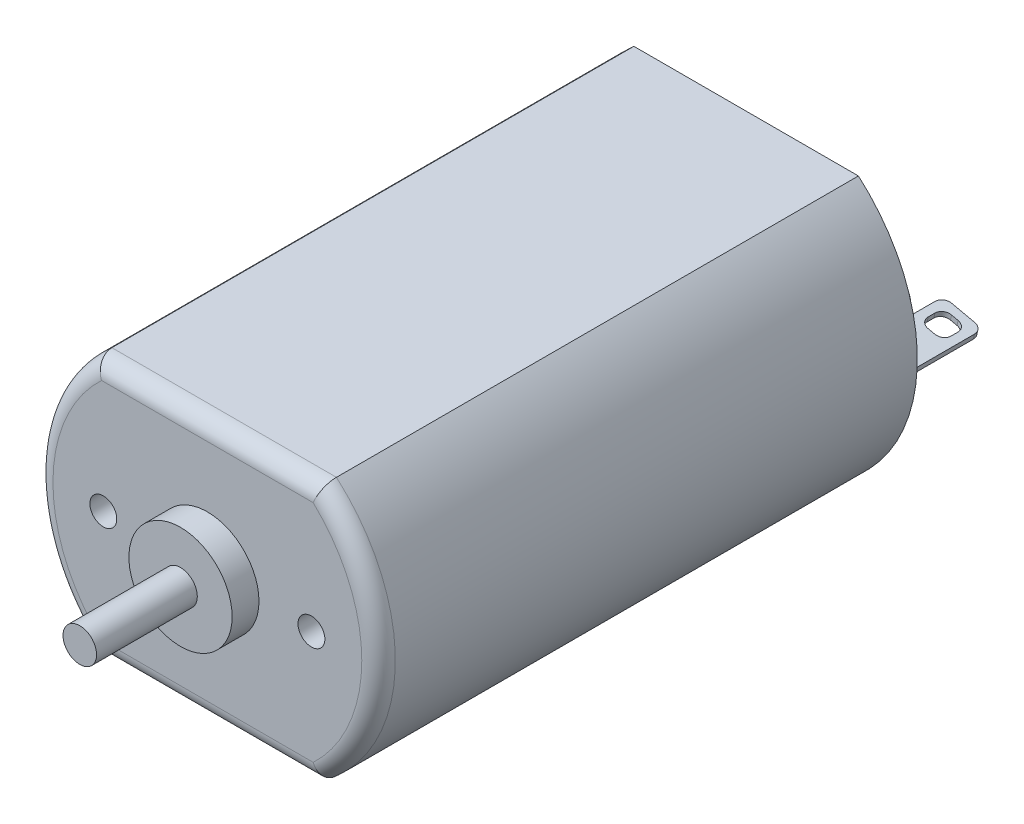
from build123d import *

# Parameters (mm, degrees)
BOSS_EXTRUDE1_DEPTH      = 32.1
SKETCH2_R                = 3.075
BOSS_EXTRUDE2_DEPTH      = 1.6
BOSS_EXTRUDE3_START      = 2.1
SKETCH3_R                = 3.075
BOSS_EXTRUDE3_DEPTH      = 2.1
M2_TAPPED_HOLE1_D        = 1.6
M2_TAPPED_HOLE1_DEPTH    = 6
M2_TAPPED_HOLE1_TIP      = 0.480688495
SKETCH6_R                = 1.2
SKETCH6_R_2              = 1.5
BOSS_EXTRUDE4_DEPTH      = 1
SKETCH7_R                = 1
BOSS_EXTRUDE5_DEPTH      = 6
FILLET1_R                = 1
FILLET2_R                = 0.5
BOSS_EXTRUDE6_DEPTH      = 0.15
BOSS_EXTRUDE6_DEPTH_BACK = 0.15
SKETCH9_W                = 1.4
SKETCH9_H                = 1.4
FILLET3_R                = 0.5


with BuildPart() as part:
    # Sketch1 → Boss-Extrude1 (new body)
    with BuildSketch(Plane.XY):
        with BuildLine():
            Line((-6.68954408, 7.7), (6.68954408, 7.7))
            ThreePointArc((6.68954408, 7.7), (10.2, 0), (6.68954408, -7.7))
            Line((6.68954408, -7.7), (-6.68954408, -7.7))
            ThreePointArc((-6.68954408, -7.7), (-10.2, 0), (-6.68954408, 7.7))
        make_face()
    extrude(amount=BOSS_EXTRUDE1_DEPTH)

    # Sketch2 → Boss-Extrude2 (add)
    with BuildSketch(Plane.XY.offset(32.1)):
        Circle(SKETCH2_R)
    extrude(amount=BOSS_EXTRUDE2_DEPTH)

    # Sketch3 → Boss-Extrude3 (add)
    with BuildSketch(Plane(origin=(0, 0, 0), x_dir=(-1, 0, 0), z_dir=(0, 0, -1)).offset(BOSS_EXTRUDE3_START)):
        Circle(SKETCH3_R)
    extrude(amount=-BOSS_EXTRUDE3_DEPTH)

    # M2 Tapped Hole1
    with Locations(Plane.XY.offset(32.1)):
        with Locations((-6.2, 0), (6.2, 0)):
            Hole(M2_TAPPED_HOLE1_D / 2, depth=M2_TAPPED_HOLE1_DEPTH)
            with Locations((0, 0, -(M2_TAPPED_HOLE1_DEPTH + M2_TAPPED_HOLE1_TIP / 2))):  # 118° drill point
                Cone(0, M2_TAPPED_HOLE1_D / 2, M2_TAPPED_HOLE1_TIP, mode=Mode.SUBTRACT)

    # Sketch6 → Boss-Extrude4 (add)
    with BuildSketch(Plane(origin=(0, 0, 0), x_dir=(-1, 0, 0), z_dir=(0, 0, -1))):
        with Locations((-7.6, 1.69)):
            Circle(SKETCH6_R)
        with Locations((7.6, -1.69)):
            Circle(SKETCH6_R)
        with Locations((-7.6, -1.69)):
            Circle(SKETCH6_R_2)
        with Locations((7.6, 1.69)):
            Circle(SKETCH6_R_2)
    extrude(amount=BOSS_EXTRUDE4_DEPTH)

    # Sketch7 → Boss-Extrude5 (add)
    with BuildSketch(Plane.XY.offset(33.7)):
        Circle(SKETCH7_R)
    extrude(amount=BOSS_EXTRUDE5_DEPTH)

    # Fillet1
    fillet1_edges = [part.edges().sort_by_distance(p)[0] for p in [
        (0, -7.7, 32.1),
        (10.2, 0, 32.1),
        (0, 7.7, 32.1),
        (-10.2, 0, 32.1),
    ]]
    fillet(fillet1_edges, radius=FILLET1_R)

    # Fillet2
    fillet2_edges = [part.edges().sort_by_distance(p)[0] for p in [
        (3.075, 0, 0),
        (3.075, 0, -2.1),
    ]]
    fillet(fillet2_edges, radius=FILLET2_R)

    # Sketch9 → Boss-Extrude6 (add, two sides: drawn at the far end of the back side and taken through both)
    # profile 1 of 2: a face of its own
    with BuildSketch(Plane(origin=(0, 0, 0), x_dir=(-0.9761568291371078, 0.2170664527949621, 0), z_dir=(-0.21706645279496206, -0.9761568291371077, 0)).offset(-BOSS_EXTRUDE6_DEPTH_BACK)):
        with BuildLine():
            Line((-8.985634207, 1), (-6.585634207, 1))
            Line((-6.585634207, 1), (-6.585634207, 4.8))
            ThreePointArc((-6.585634207, 4.8), (-6.732080816, 5.153553391), (-7.085634207, 5.3))
            Line((-7.085634207, 5.3), (-8.485634207, 5.3))
            ThreePointArc((-8.485634207, 5.3), (-8.839187597, 5.153553391), (-8.985634207, 4.8))
            Line((-8.985634207, 4.8), (-8.985634207, 1))
        make_face()
        with Locations((-7.785634207, 4.1)):
            Rectangle(SKETCH9_W, SKETCH9_H, mode=Mode.SUBTRACT)
    # profile 2 of 2: a face of its own
    with BuildSketch(Plane(origin=(0, 0, 0), x_dir=(-0.9761568291371078, 0.2170664527949621, 0), z_dir=(-0.21706645279496206, -0.9761568291371077, 0)).offset(-BOSS_EXTRUDE6_DEPTH_BACK)):
        with BuildLine():
            Line((8.985634207, 1), (6.585634207, 1))
            Line((6.585634207, 1), (6.585634207, 4.8))
            ThreePointArc((6.585634207, 4.8), (6.732080816, 5.153553391), (7.085634207, 5.3))
            Line((7.085634207, 5.3), (8.485634207, 5.3))
            ThreePointArc((8.485634207, 5.3), (8.839187597, 5.153553391), (8.985634207, 4.8))
            Line((8.985634207, 4.8), (8.985634207, 1))
        make_face()
        with Locations((7.785634207, 4.1)):
            Rectangle(SKETCH9_W, SKETCH9_H, mode=Mode.SUBTRACT)
    extrude(amount=BOSS_EXTRUDE6_DEPTH + BOSS_EXTRUDE6_DEPTH_BACK)

    # Fillet3
    fillet3_edges = [part.edges().sort_by_distance(p)[0] for p in [
        (-6.91669022, 1.538053483, -3.4),
        (-6.91669022, 1.538053483, -4.8),
        (-8.28330978, 1.841946517, -4.8),
        (-8.28330978, 1.841946517, -3.4),
        (8.28330978, -1.841946517, -3.4),
        (8.28330978, -1.841946517, -4.8),
        (6.91669022, -1.538053483, -4.8),
        (6.91669022, -1.538053483, -3.4),
    ]]
    fillet(fillet3_edges, radius=FILLET3_R)


solid = part.part
